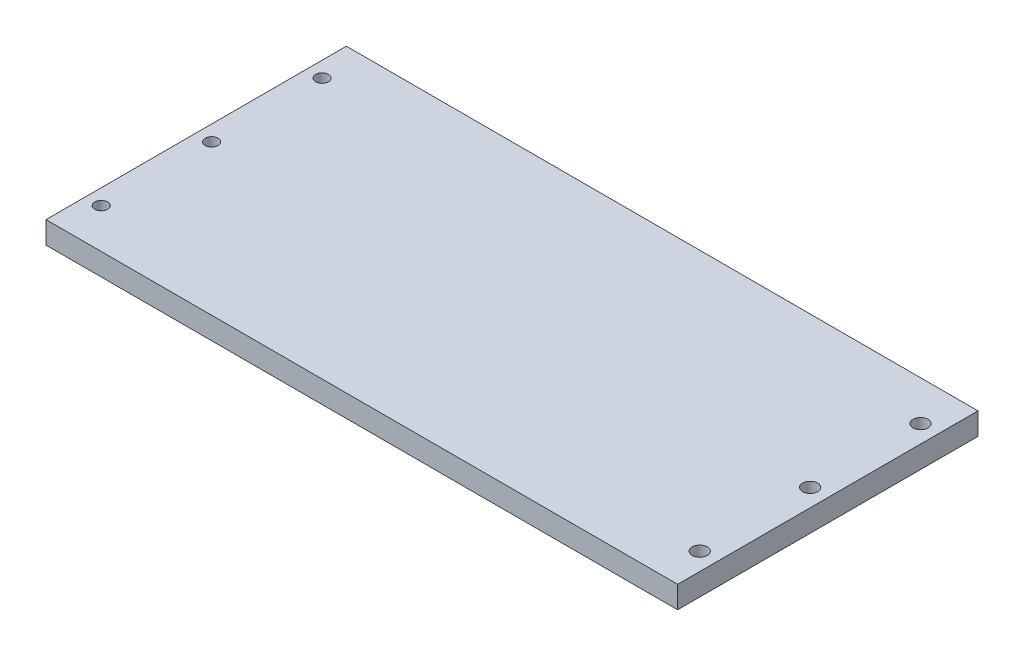
from build123d import *

# Parameters (mm, degrees)
SKETCH_1_W                     = 143
SKETCH_1_H                     = 68
EXTRUDE_1_DEPTH                = 5
HOLE_WIZARD_M2_5_1_D           = 2.9
HOLE_WIZARD_M2_5_1_CSINK_D     = 5.5
HOLE_WIZARD_M2_5_1_CSINK_ANGLE = 90
HOLE_WIZARD_M3_1_D             = 3.4
HOLE_WIZARD_M3_1_CSINK_D       = 6.3
HOLE_WIZARD_M3_1_CSINK_ANGLE   = 90


with BuildPart() as part:
    # 草圖1 → 填料-伸長1 (new body)
    with BuildSketch(Plane(origin=(0, 0, 0), x_dir=(1, 0, 0), z_dir=(0, 1, 0))):
        Rectangle(SKETCH_1_W, SKETCH_1_H)
    extrude(amount=EXTRUDE_1_DEPTH)

    # M2.5 錐坑平頭螺釘的錐孔1 (through all)
    with Locations(Plane(origin=(0, 0, 0), x_dir=(-1, 0, 0), z_dir=(0, -1, 0))):
        with Locations((68, 25), (68, 0), (68, -25)):
            CounterSinkHole(HOLE_WIZARD_M2_5_1_D / 2, HOLE_WIZARD_M2_5_1_CSINK_D / 2, counter_sink_angle=HOLE_WIZARD_M2_5_1_CSINK_ANGLE)

    # M3 錐坑平頭螺釘的錐孔1 (through all)
    with Locations(Plane(origin=(0, 0, 0), x_dir=(-1, 0, 0), z_dir=(0, -1, 0))):
        with Locations((-67.5, 25), (-67.5, 0), (-67.5, -25)):
            CounterSinkHole(HOLE_WIZARD_M3_1_D / 2, HOLE_WIZARD_M3_1_CSINK_D / 2, counter_sink_angle=HOLE_WIZARD_M3_1_CSINK_ANGLE)


solid = part.part
